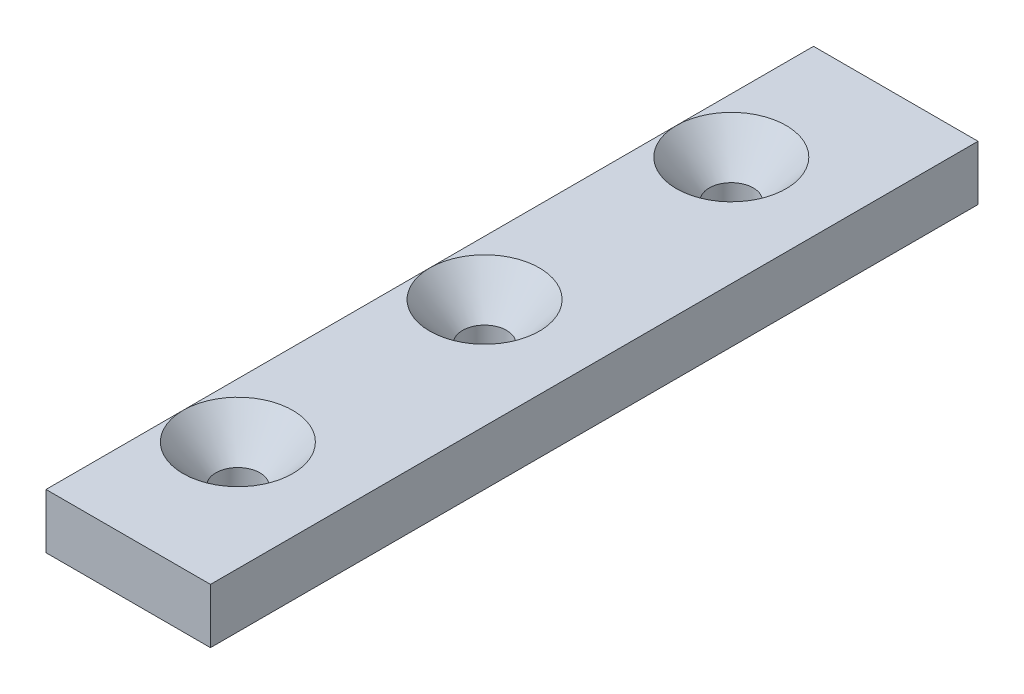
from build123d import *

# Parameters (mm, degrees)
SKETCH1_W                        = 19.05
SKETCH1_H                        = 88.9
BOSS_EXTRUDE1_DEPTH              = 6.35
F_1_4_20_TAPPED_HOLE1_AT_2_COUNT = 2
F_1_4_20_TAPPED_HOLE1_AT_2_PITCH = 28.575
F_1_4_20_TAPPED_HOLE1_AT_3_COUNT = 2
F_1_4_20_TAPPED_HOLE1_AT_3_PITCH = 57.15


with BuildPart() as part:
    # Sketch1 → Boss-Extrude1 (new body)
    with BuildSketch(Plane(origin=(0, 0, 0), x_dir=(1, 0, 0), z_dir=(0, 1, 0))):
        with Locations((-9.525, 44.45)):
            Rectangle(SKETCH1_W, SKETCH1_H)
    extrude(amount=BOSS_EXTRUDE1_DEPTH)

    # Sketch3 → 1/4-20 Tapped Hole1 (revolve, cut)
    with BuildSketch(Plane(origin=(-12.7, 6.35, -15.875), x_dir=(0, 0, 1), z_dir=(1, 0, 0))):
        Polygon((0, 0), (0, 6.35), (2.5527, 6.35), (2.5527, 4.368293953), (6.35, 0), align=None)
    f_1_4_20_tapped_hole1 = revolve(axis=Axis((-12.7, 12.7, -15.875), (0, -1, 0)), mode=Mode.SUBTRACT)

    # 1/4-20 Tapped Hole1 at 2: 1/4-20 Tapped Hole1 ×2
    with Locations(*[(0, 0, -i * F_1_4_20_TAPPED_HOLE1_AT_2_PITCH) for i in range(1, F_1_4_20_TAPPED_HOLE1_AT_2_COUNT)]):
        add(f_1_4_20_tapped_hole1, mode=Mode.SUBTRACT)

    # 1/4-20 Tapped Hole1 at 3: 1/4-20 Tapped Hole1 ×2
    with Locations(*[(0, 0, -i * F_1_4_20_TAPPED_HOLE1_AT_3_PITCH) for i in range(1, F_1_4_20_TAPPED_HOLE1_AT_3_COUNT)]):
        add(f_1_4_20_tapped_hole1, mode=Mode.SUBTRACT)


solid = part.part
